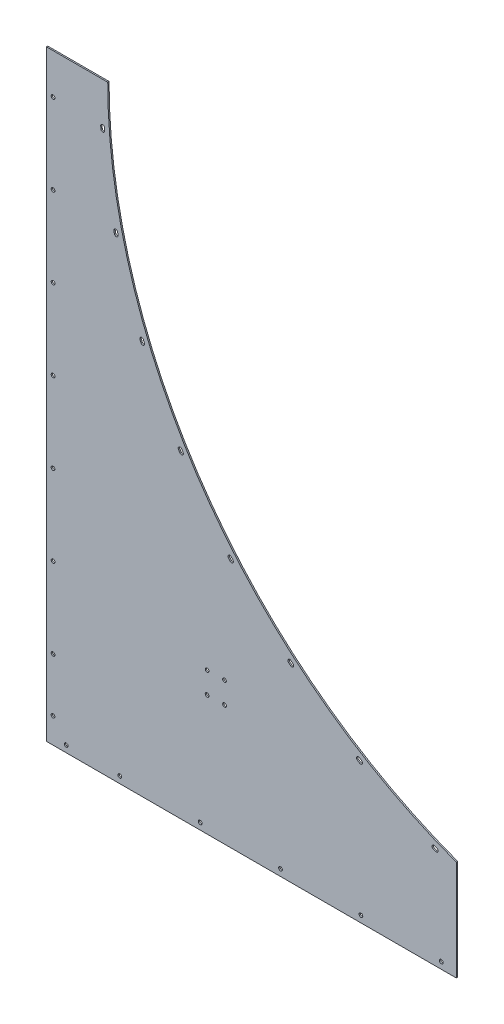
from build123d import *

# Parameters (mm, degrees)
SKETCH1_R           = 7
BOSS_EXTRUDE1_DEPTH = 5


with BuildPart() as part:
    # Sketch1 → Boss-Extrude1 (new body)
    with BuildSketch(Plane.XY):
        with BuildLine():
            Line((1502.640695659, 642.154083815), (1502.640695659, 267.552169785))
            Line((1502.640695659, 267.552169785), (-27.359304341, 267.552169785))
            Line((-27.359304341, 267.552169785), (-27.359304341, 2512.552169785))
            Line((-27.359304341, 2512.552169785), (201.640695659, 2512.552169785))
            ThreePointArc((201.640695659, 2512.552169785), (558.874686731, 1373.364959534), (1502.640695659, 642.154083815))
        make_face()
        with Locations((1446.640695659, 292.552169785)):
            Circle(SKETCH1_R, mode=Mode.SUBTRACT)
        with Locations((1146.640695659, 292.552169785)):
            Circle(SKETCH1_R, mode=Mode.SUBTRACT)
        with Locations((846.640695659, 292.552169785)):
            Circle(SKETCH1_R, mode=Mode.SUBTRACT)
        with Locations((546.640695659, 292.552169785)):
            Circle(SKETCH1_R, mode=Mode.SUBTRACT)
        with Locations((246.640695659, 292.552169785)):
            Circle(SKETCH1_R, mode=Mode.SUBTRACT)
        with Locations((46.640695659, 292.552169785)):
            Circle(SKETCH1_R, mode=Mode.SUBTRACT)
        with Locations((-2.359304341, 362.552169785)):
            Circle(SKETCH1_R, mode=Mode.SUBTRACT)
        with Locations((-2.359304341, 562.552169785)):
            Circle(SKETCH1_R, mode=Mode.SUBTRACT)
        with Locations((-2.359304341, 862.552169785)):
            Circle(SKETCH1_R, mode=Mode.SUBTRACT)
        with Locations((-2.359304341, 1162.552169785)):
            Circle(SKETCH1_R, mode=Mode.SUBTRACT)
        with Locations((-2.359304341, 1462.552169785)):
            Circle(SKETCH1_R, mode=Mode.SUBTRACT)
        with Locations((-2.359304341, 1762.552169785)):
            Circle(SKETCH1_R, mode=Mode.SUBTRACT)
        with Locations((-2.359304341, 2062.552169785)):
            Circle(SKETCH1_R, mode=Mode.SUBTRACT)
        with Locations((-2.359304341, 2362.552169785)):
            Circle(SKETCH1_R, mode=Mode.SUBTRACT)
        with Locations((572.640695659, 717.552169785)):
            Circle(SKETCH1_R, mode=Mode.SUBTRACT)
        with Locations((637.640695659, 717.552169785)):
            Circle(SKETCH1_R, mode=Mode.SUBTRACT)
        with Locations((572.640695659, 797.552169785)):
            Circle(SKETCH1_R, mode=Mode.SUBTRACT)
        with Locations((637.640695659, 797.552169785)):
            Circle(SKETCH1_R, mode=Mode.SUBTRACT)
        with BuildLine():
            Line((190.238398333, 2349.629423417), (189.453807376, 2359.598596754))
            ThreePointArc((189.453807376, 2359.598596754), (181.926172369, 2366.02780442), (175.496964703, 2358.500169414))
            Line((175.496964703, 2358.500169414), (176.281555661, 2348.530996076))
            ThreePointArc((176.281555661, 2348.530996076), (183.809190667, 2342.10178841), (190.238398333, 2349.629423417))
        make_face(mode=Mode.SUBTRACT)
        with BuildLine():
            Line((240.427272718, 2037.764802741), (238.092819079, 2047.488501945))
            ThreePointArc((238.092819079, 2047.488501945), (229.652112089, 2052.660973841), (224.479640194, 2044.220266851))
            Line((224.479640194, 2044.220266851), (226.814093832, 2034.496567648))
            ThreePointArc((226.814093832, 2034.496567648), (235.254800822, 2029.324095752), (240.427272718, 2037.764802741))
        make_face(mode=Mode.SUBTRACT)
        with BuildLine():
            Line((338.784613876, 1737.591022772), (334.957779552, 1746.829818097))
            ThreePointArc((334.957779552, 1746.829818097), (325.811838798, 1750.618190798), (322.023466097, 1741.472250044))
            Line((322.023466097, 1741.472250044), (325.85030042, 1732.233454719))
            ThreePointArc((325.85030042, 1732.233454719), (334.996241175, 1728.445082018), (338.784613876, 1737.591022772))
        make_face(mode=Mode.SUBTRACT)
        with BuildLine():
            Line((482.888537638, 1456.49935819), (477.663551991, 1465.025759834))
            ThreePointArc((477.663551991, 1465.025759834), (468.037581727, 1467.33674966), (465.72658969, 1457.710779928))
            Line((465.72658969, 1457.710779928), (470.951575337, 1449.184378284))
            ThreePointArc((470.951575337, 1449.184378284), (480.57754644, 1446.873387087), (482.888537638, 1456.49935819))
        make_face(mode=Mode.SUBTRACT)
        with BuildLine():
            Line((669.190727148, 1201.411218669), (662.696246664, 1209.015278325))
            ThreePointArc((662.696246664, 1209.015278325), (652.827268567, 1209.791983746), (652.050563146, 1199.923005648))
            Line((652.050563146, 1199.923005648), (658.545043629, 1192.318945992))
            ThreePointArc((658.545043629, 1192.318945992), (668.414021727, 1191.542240571), (669.190727148, 1201.411218669))
        make_face(mode=Mode.SUBTRACT)
        with BuildLine():
            Line((893.103804198, 978.607720791), (885.499744542, 985.102201274))
            ThreePointArc((885.499744542, 985.102201274), (875.630766445, 984.325495853), (876.407471866, 974.456517756))
            Line((876.407471866, 974.456517756), (884.011531522, 967.962037273))
            ThreePointArc((884.011531522, 967.962037273), (893.880509619, 968.738742693), (893.103804198, 978.607720791))
        make_face(mode=Mode.SUBTRACT)
        with BuildLine():
            Line((1149.114285708, 793.575026117), (1140.587884064, 798.800011764))
            ThreePointArc((1140.587884064, 798.800011764), (1130.961912961, 796.489020567), (1133.272904158, 786.863049463))
            Line((1133.272904158, 786.863049463), (1141.799305802, 781.638063816))
            ThreePointArc((1141.799305802, 781.638063816), (1151.425276905, 783.949055014), (1149.114285708, 793.575026117))
        make_face(mode=Mode.SUBTRACT)
        with BuildLine():
            Line((1430.918343971, 650.869253678), (1421.679548646, 654.696088002))
            ThreePointArc((1421.679548646, 654.696088002), (1412.533607891, 650.907715301), (1416.321980592, 641.761774547))
            Line((1416.321980592, 641.761774547), (1425.560775918, 637.934940223))
            ThreePointArc((1425.560775918, 637.934940223), (1434.706716672, 641.723312924), (1430.918343971, 650.869253678))
        make_face(mode=Mode.SUBTRACT)
    extrude(amount=BOSS_EXTRUDE1_DEPTH)


solid = part.part
